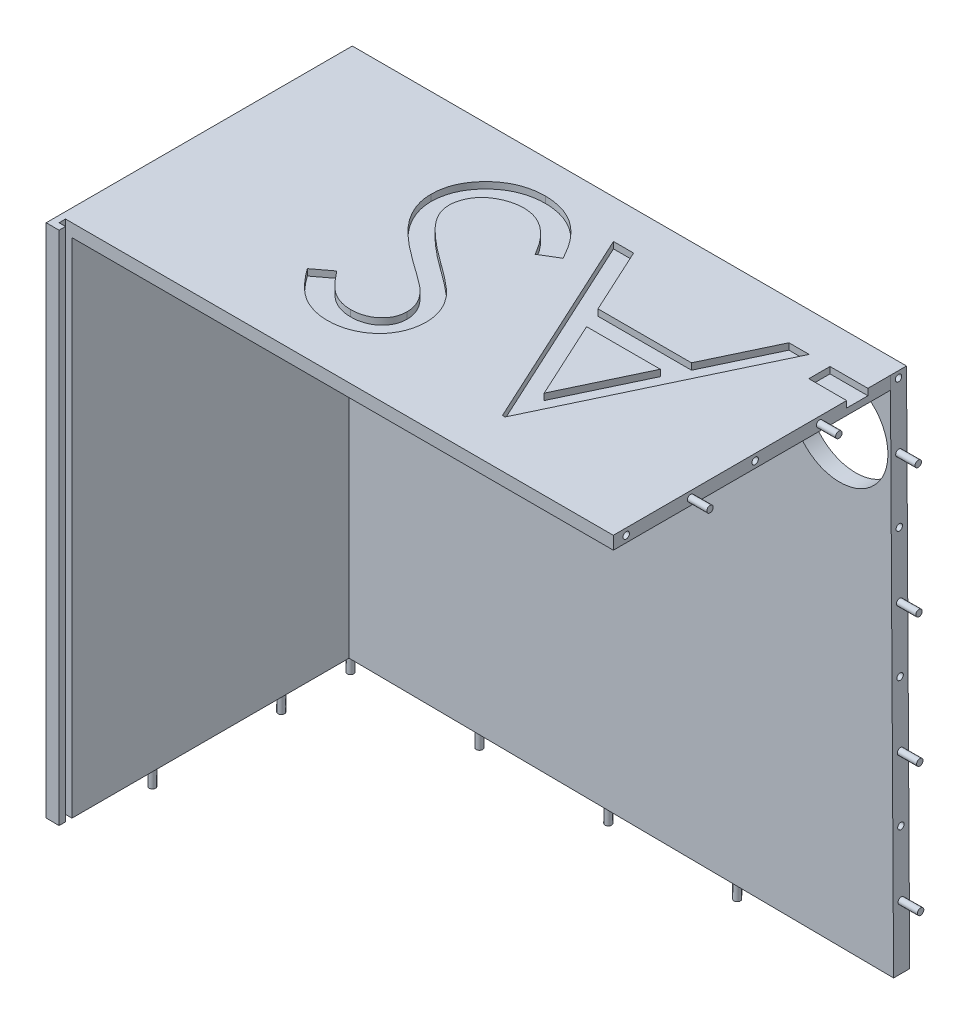
from build123d import *

# Parameters (mm, degrees)
SALIENTE_EXTRUIR1_DEPTH = 2.5
SALIENTE_EXTRUIR2_DEPTH = 45
CROQUIS17_R             = 7.5
CROQUIS17_R_2           = 2
CROQUIS17_R_3           = 1.5
CORTAR_EXTRUIR2_DEPTH   = 45
CORTAR_EXTRUIR3_DEPTH   = 105
CORTAR_EXTRUIR6_DEPTH   = 45
CORTAR_EXTRUIR8_DEPTH   = 1
CORTAR_EXTRUIR9_DEPTH   = 1
CROQUIS22_R             = 0.5
CORTAR_EXTRUIR10_DEPTH  = 4
CROQUIS24_R             = 0.5
SALIENTE_EXTRUIR3_DEPTH = 3
CROQUIS25_R             = 0.5
CORTAR_EXTRUIR11_DEPTH  = 4
CROQUIS27_R             = 0.5
SALIENTE_EXTRUIR4_DEPTH = 3
CROQUIS28_R             = 0.5
SALIENTE_EXTRUIR5_DEPTH = 3
CROQUIS29_R             = 0.5
CORTAR_EXTRUIR12_DEPTH  = 4
CROQUIS30_R             = 0.5
SALIENTE_EXTRUIR6_DEPTH = 3
CROQUIS31_R             = 0.5
CORTAR_EXTRUIR13_DEPTH  = 4


with BuildPart() as part:
    # Croquis15 → Saliente-Extruir1 (new body)
    with BuildSketch(Plane.XY):
        Polygon((0, 80), (-86, 80), (-86, 0), (0.493585448, -0.747010607), align=None)
    extrude(amount=SALIENTE_EXTRUIR1_DEPTH)

    # Croquis16 → Saliente-Extruir2 (add)
    with BuildSketch(Plane.XY.offset(2.5)):
        Polygon((-86, 0), (-84, -0.017027708), (-84, 78), (0.01204005, 78), (0, 80), (-86, 80), align=None)
    extrude(amount=SALIENTE_EXTRUIR2_DEPTH)

    # Croquis17 → Cortar-Extruir2 (cut)
    with BuildSketch(Plane.XY.offset(2.5)):
        with Locations((-7.879599497, 69.200049458)):
            Circle(CROQUIS17_R)
        with Locations((-80, 74)):
            Circle(CROQUIS17_R_2)
        with Locations((-49, 45)):
            Circle(CROQUIS17_R_3)
    extrude(amount=-CORTAR_EXTRUIR2_DEPTH, mode=Mode.SUBTRACT)

    # Croquis18 → Cortar-Extruir3 (cut)
    with BuildSketch(Plane(origin=(0, 80, 0), x_dir=(1, 0, 0), z_dir=(0, 1, 0))):
        Polygon((0, -46.5), (-85, -46.5), (-85, -45.5), (0, -45.5), (0.836064451, -45.5), (0.836064451, -46.5), align=None)
    extrude(amount=-CORTAR_EXTRUIR3_DEPTH, mode=Mode.SUBTRACT)

    # Croquis19 → Cortar-Extruir6 (cut)
    with BuildSketch(Plane(origin=(0, 80, 0), x_dir=(1, 0, 0), z_dir=(0, 1, 0))):
        Polygon((0, -47.5), (-84, -47.5), (-84, -46.5), (0, -46.5), (1.11353995, -46.5), (1.11353995, -47.5), align=None)
    extrude(amount=-CORTAR_EXTRUIR6_DEPTH, mode=Mode.SUBTRACT)

    # Croquis20 → Cortar-Extruir8 (cut)
    with BuildSketch(Plane.ZY.offset(86)):
        with BuildLine():
            Line((42.8897921, 39.727977752), (39.414990694, 47.892710802))
            Line((39.414990694, 47.892710802), (39.175320374, 47.811910054))
            Line((39.175320374, 47.811910054), (36.084007053, 55.49332965))
            ThreePointArc((36.084007053, 55.49332965), (34.421934883, 58.963358815), (32.02982381, 61.976893438))
            ThreePointArc((32.02982381, 61.976893438), (23.84274989, 67.044580137), (14.259741606, 66.108855781))
            Line((14.259741606, 66.108855781), (17.533100352, 66.108855781))
            Line((17.533100352, 66.108855781), (17.793929067, 66.369684496))
            ThreePointArc((17.793929067, 66.369684496), (28.36338955, 63.257555009), (34.992482388, 54.456761125))
            Line((34.992482388, 54.456761125), (37.846876491, 47.364047925))
            Line((37.846876491, 47.364047925), (37.634571287, 47.292472857))
            Line((37.634571287, 47.292472857), (40.778374259, 39.577754196))
            Line((40.778374259, 39.577754196), (37.634571287, 31.930129052))
            Line((37.634571287, 31.930129052), (37.846876491, 31.860535129))
            Line((37.846876491, 31.860535129), (34.51899092, 23.472535747))
            ThreePointArc((34.51899092, 23.472535747), (27.809502812, 15.712037776), (17.947872224, 12.885237188))
            Line((17.947872224, 12.885237188), (17.727881267, 13.105228146))
            Line((17.727881267, 13.105228146), (14.423853052, 13.105228146))
            ThreePointArc((14.423853052, 13.105228146), (22.17340631, 11.809910211), (29.393055563, 14.90992455))
            ThreePointArc((29.393055563, 14.90992455), (33.211326955, 18.443558236), (35.752716257, 22.983063042))
            Line((35.752716257, 22.983063042), (39.272948575, 31.393066837))
            Line((39.272948575, 31.393066837), (39.53262788, 31.307943622))
            Line((39.53262788, 31.307943622), (42.8897921, 39.727977752))
        make_face()
        with BuildLine():
            Line((36.378905898, 46.851834675), (36.084007053, 46.752414574))
            Line((36.084007053, 46.752414574), (32.640801094, 55.132550687))
            ThreePointArc((32.640801094, 55.132550687), (27.524167793, 61.619465369), (19.754472007, 64.428704734))
            Line((19.754472007, 64.428704734), (16.511391589, 64.428704734))
            Line((16.511391589, 64.428704734), (16.708822752, 64.778805627))
            Line((16.708822752, 64.778805627), (11.827523811, 64.778805627))
            ThreePointArc((11.827523811, 64.778805627), (10.608915982, 63.831457631), (9.536616451, 62.72121127))
            Line((9.536616451, 62.72121127), (15.359832149, 62.72121127))
            Line((15.359832149, 62.72121127), (15.511736691, 62.990580681))
            Line((15.511736691, 62.990580681), (19.660348072, 62.990580681))
            ThreePointArc((19.660348072, 62.990580681), (26.8054156, 60.278147026), (31.47565436, 54.228506026))
            Line((31.47565436, 54.228506026), (34.785611277, 46.31468265))
            Line((34.785611277, 46.31468265), (34.433889886, 46.1961058))
            Line((34.433889886, 46.1961058), (37.110752235, 39.627233609))
            Line((37.110752235, 39.627233609), (34.433889886, 32.980380104))
            Line((34.433889886, 32.980380104), (34.728886655, 32.879428436))
            Line((34.728886655, 32.879428436), (31.316821564, 24.514916669))
            ThreePointArc((31.316821564, 24.514916669), (26.041252488, 18.464113022), (18.336433636, 16.210311718))
            Line((18.336433636, 16.210311718), (15.679957488, 16.210311718))
            Line((15.679957488, 16.210311718), (15.452163697, 16.54253363))
            Line((15.452163697, 16.54253363), (9.759164883, 16.54253363))
            ThreePointArc((9.759164883, 16.54253363), (10.728989856, 15.358692755), (11.954185083, 14.441666938))
            Line((11.954185083, 14.441666938), (16.850619146, 14.502980491))
            Line((16.850619146, 14.502980491), (16.667447006, 14.770124728))
            Line((16.667447006, 14.770124728), (19.512924134, 14.770124728))
            ThreePointArc((19.512924134, 14.770124728), (27.395346959, 17.492041697), (32.640801094, 23.97483681))
            Line((32.640801094, 23.97483681), (36.084007053, 32.415688904))
            Line((36.084007053, 32.415688904), (36.414908323, 32.302450257))
            Line((36.414908323, 32.302450257), (39.292664306, 39.577754196))
            Line((39.292664306, 39.577754196), (36.378905898, 46.851834675))
        make_face()
        with BuildLine():
            Line((35.706804957, 39.627233609), (33.162337341, 45.796005131))
            Line((33.162337341, 45.796005131), (32.922678734, 45.715548031))
            Line((32.922678734, 45.715548031), (29.062452452, 54.949970455))
            ThreePointArc((29.062452452, 54.949970455), (24.967702651, 59.263861985), (19.323687612, 61.140489358))
            Line((19.323687612, 61.140489358), (14.259741606, 61.140489358))
            Line((14.259741606, 61.140489358), (14.385275351, 61.445187248))
            Line((14.385275351, 61.445187248), (8.456515485, 61.445187248))
            ThreePointArc((8.456515485, 61.445187248), (7.755035998, 60.452090199), (7.158136913, 59.39283258))
            Line((7.158136913, 59.39283258), (13.154860793, 59.39283258))
            Line((13.154860793, 59.39283258), (13.363644099, 59.717274132))
            Line((13.363644099, 59.717274132), (18.567607292, 59.717274132))
            ThreePointArc((18.567607292, 59.717274132), (24.452832298, 57.927933166), (28.346074774, 53.165551671))
            Line((28.346074774, 53.165551671), (31.593369932, 45.269278514))
            Line((31.593369932, 45.269278514), (31.316821564, 45.176436951))
            Line((31.316821564, 45.176436951), (33.577860357, 39.577754196))
            Line((33.577860357, 39.577754196), (31.316821564, 34.018627994))
            Line((31.316821564, 34.018627994), (31.602317749, 33.922066161))
            Line((31.602317749, 33.922066161), (28.042275456, 25.309983169))
            ThreePointArc((28.042275456, 25.309983169), (24.379497281, 21.196888717), (19.151906793, 19.463167972))
            Line((19.151906793, 19.463167972), (13.514746805, 19.463167972))
            Line((13.514746805, 19.463167972), (13.284980904, 19.847972334))
            Line((13.284980904, 19.847972334), (7.401798859, 19.847972334))
            ThreePointArc((7.401798859, 19.847972334), (7.922755232, 18.773921668), (8.621160615, 17.805825445))
            Line((8.621160615, 17.805825445), (14.603954756, 17.805825445))
            Line((14.603954756, 17.805825445), (14.423853052, 18.107453844))
            Line((14.423853052, 18.107453844), (19.151906793, 18.107453844))
            ThreePointArc((19.151906793, 18.107453844), (25.17240984, 20.020462092), (29.32760377, 24.778657222))
            Line((29.32760377, 24.778657222), (32.922678734, 33.475487595))
            Line((32.922678734, 33.475487595), (33.162337341, 33.394429159))
            Line((33.162337341, 33.394429159), (35.706804957, 39.627233609))
        make_face()
        with BuildLine():
            Line((32.0938438, 39.573448775), (30.001592281, 44.754188061))
            Line((30.001592281, 44.754188061), (29.751017182, 44.66458782))
            Line((29.751017182, 44.66458782), (26.244414428, 53.133099997))
            ThreePointArc((26.244414428, 53.133099997), (23.275186955, 56.429114318), (19.046156691, 57.769011781))
            Line((19.046156691, 57.769011781), (12.100590668, 57.769011781))
            Line((12.100590668, 57.769011781), (12.250050494, 58.04536961))
            Line((12.250050494, 58.04536961), (6.624024953, 58.04536961))
            ThreePointArc((6.624024953, 58.04536961), (6.237685393, 57.055466805), (5.943728696, 56.03431291))
            Line((5.943728696, 56.03431291), (10.926169077, 56.03431291))
            Line((10.926169077, 56.03431291), (11.097634026, 56.351359185))
            Line((11.097634026, 56.351359185), (19.046156691, 56.351359185))
            ThreePointArc((19.046156691, 56.351359185), (22.458473426, 55.196829291), (24.953748351, 52.598666896))
            Line((24.953748351, 52.598666896), (28.360684999, 44.167435075))
            Line((28.360684999, 44.167435075), (28.110544995, 44.077990415))
            Line((28.110544995, 44.077990415), (29.929712795, 39.573448775))
            Line((29.929712795, 39.573448775), (28.163024397, 35.085319779))
            Line((28.163024397, 35.085319779), (28.397224015, 34.976504969))
            Line((28.397224015, 34.976504969), (24.830604314, 26.378839739))
            ThreePointArc((24.830604314, 26.378839739), (22.312085893, 23.862796419), (18.906393231, 22.82613518))
            Line((18.906393231, 22.82613518), (11.349527265, 22.82613518))
            Line((11.349527265, 22.82613518), (11.056235325, 23.177885435))
            Line((11.056235325, 23.177885435), (6.039306832, 23.177885435))
            ThreePointArc((6.039306832, 23.177885435), (6.321052836, 22.154061435), (6.69508021, 21.160230505))
            Line((6.69508021, 21.160230505), (12.395447121, 21.160230505))
            Line((12.395447121, 21.160230505), (12.306728353, 21.434012585))
            Line((12.306728353, 21.434012585), (19.151906793, 21.434012585))
            ThreePointArc((19.151906793, 21.434012585), (23.2575089, 22.718064865), (26.244414428, 25.813731881))
            Line((26.244414428, 25.813731881), (29.73747048, 34.552803382))
            Line((29.73747048, 34.552803382), (30.001592281, 34.463470892))
            Line((30.001592281, 34.463470892), (32.0938438, 39.573448775))
        make_face()
        with BuildLine():
            Line((26.549147801, 35.58790565), (26.85057428, 35.485955799))
            Line((26.85057428, 35.485955799), (28.445515306, 39.573448775))
            Line((28.445515306, 39.573448775), (26.790267285, 43.672099616))
            Line((26.790267285, 43.672099616), (26.549147801, 43.591152077))
            Line((26.549147801, 43.591152077), (23.317591904, 51.41873789))
            ThreePointArc((23.317591904, 51.41873789), (21.513307882, 53.62120693), (18.788989341, 54.448491159))
            Line((18.788989341, 54.448491159), (9.874134615, 54.448491159))
            Line((9.874134615, 54.448491159), (9.974396179, 54.647804874))
            Line((9.974396179, 54.647804874), (5.684786898, 54.647804874))
            Line((5.684786898, 54.647804874), (5.466800204, 52.62607257))
            Line((5.466800204, 52.62607257), (8.708953764, 52.62607257))
            Line((8.708953764, 52.62607257), (8.948743884, 52.971119817))
            Line((8.948743884, 52.971119817), (19.323687612, 53.025155561))
            ThreePointArc((19.323687612, 53.025155561), (20.742059289, 52.420442498), (21.848581651, 51.346634152))
            Line((21.848581651, 51.346634152), (25.232810997, 43.14923746))
            Line((25.232810997, 43.14923746), (24.953748351, 43.055551815))
            Line((24.953748351, 43.055551815), (26.360002357, 39.573448775))
            Line((26.360002357, 39.573448775), (24.997704742, 36.112641857))
            Line((24.997704742, 36.112641857), (25.232810997, 36.033123138))
            Line((25.232810997, 36.033123138), (22.072440339, 28.235984023))
            ThreePointArc((22.072440339, 28.235984023), (20.891743947, 26.805815926), (19.151906793, 26.16363882))
            Line((19.151906793, 26.16363882), (9.088365094, 26.16363882))
            Line((9.088365094, 26.16363882), (8.894687749, 26.495883132))
            Line((8.894687749, 26.495883132), (5.627893891, 26.495883132))
            Line((5.627893891, 26.495883132), (5.777935509, 24.523541078))
            Line((5.777935509, 24.523541078), (10.139925442, 24.523541078))
            Line((10.139925442, 24.523541078), (9.974396179, 24.778657222))
            Line((9.974396179, 24.778657222), (19.151906793, 24.778657222))
            ThreePointArc((19.151906793, 24.778657222), (21.70744673, 25.608994997), (23.383589887, 27.709182919))
            Line((23.383589887, 27.709182919), (26.549147801, 35.58790565))
        make_face()
        with BuildLine():
            Line((21.848581651, 41.991016085), (22.097145968, 42.074462969))
            Line((22.097145968, 42.074462969), (19.061603325, 49.426468222))
            ThreePointArc((19.061603325, 49.426468222), (18.856988582, 49.590244462), (18.597185239, 49.624770866))
            Line((18.597185239, 49.624770866), (7.158136913, 49.624770866))
            Line((7.158136913, 49.624770866), (6.963054512, 49.306532604))
            Line((6.963054512, 49.306532604), (5.471803875, 49.306532604))
            Line((5.471803875, 49.306532604), (5.471803875, 51.264658732))
            Line((5.471803875, 51.264658732), (7.897895425, 51.264658732))
            Line((7.897895425, 51.264658732), (7.770410035, 51.022500789))
            Line((7.770410035, 51.022500789), (18.597185239, 51.022500789))
            ThreePointArc((18.597185239, 51.022500789), (19.792880718, 50.673412458), (20.465116651, 49.624770866))
            Line((20.465116651, 49.624770866), (23.383589887, 42.506342083))
            Line((23.383589887, 42.506342083), (23.691252956, 42.609629332))
            Line((23.691252956, 42.609629332), (24.917420311, 39.573448775))
            Line((24.917420311, 39.573448775), (23.663448956, 36.510831384))
            Line((23.663448956, 36.510831384), (23.383589887, 36.609693561))
            Line((23.383589887, 36.609693561), (20.465116651, 29.323021728))
            ThreePointArc((20.465116651, 29.323021728), (19.798347803, 28.437651312), (18.749435069, 28.079540231))
            Line((18.749435069, 28.079540231), (7.948256078, 28.079540231))
            Line((7.948256078, 28.079540231), (8.019239527, 27.869676635))
            Line((8.019239527, 27.869676635), (5.555168099, 27.869676635))
            Line((5.555168099, 27.869676635), (5.555168099, 29.800069191))
            Line((5.555168099, 29.800069191), (7.089728084, 29.800069191))
            Line((7.089728084, 29.800069191), (7.236688932, 29.52811064))
            Line((7.236688932, 29.52811064), (18.749435069, 29.52811064))
            ThreePointArc((18.749435069, 29.52811064), (18.993561078, 29.600616745), (19.151906793, 29.800069191))
            Line((19.151906793, 29.800069191), (19.328691283, 30.240303042))
            Line((19.328691283, 30.240303042), (22.072440339, 37.072866328))
            Line((22.072440339, 37.072866328), (21.811360071, 37.165094763))
            Line((21.811360071, 37.165094763), (22.797446989, 39.573448775))
            Line((22.797446989, 39.573448775), (21.848581651, 41.991016085))
        make_face()
        Polygon((21.282903507, 39.573448775), (20.465116651, 41.556079733), (20.219012446, 41.473458746), (17.658530134, 47.679543541), (6.487217062, 47.679543541), (6.415653517, 47.892710802), (5.471803875, 47.892710802), (5.471803875, 45.922754828), (5.943728696, 45.922754828), (6.084210416, 46.255690859), (16.708822752, 46.255690859), (18.86886406, 41.020193058), (18.597185239, 40.928986277), (19.129216982, 39.573448775), (18.570319449, 38.208434096), (18.86886406, 38.11743939), (16.758083608, 32.861112837), (6.145199261, 32.861112837), (5.999887867, 33.133770419), (5.555168099, 33.133770419), (5.555168099, 31.222014808), (6.554523547, 31.222014808), (6.554523547, 31.435091919), (17.727881267, 31.435091919), (20.243106325, 37.698578135), (20.465116651, 37.630910645), align=None)
        Polygon((17.622177995, 39.573448775), (17.291311599, 40.416446987), (16.97849747, 40.416446987), (15.401311112, 44.239223747), (5.471803875, 44.239223747), (5.471803875, 42.868185711), (14.482395706, 42.868185711), (15.882323221, 39.573448775), (14.518563776, 36.194537462), (5.471803875, 36.194537462), (5.471803875, 34.882450429), (15.401311112, 34.882450429), (16.97849747, 38.695032164), (17.291311599, 38.695032164), align=None)
        Polygon((13.730826124, 39.573448775), (13.154860793, 40.928986277), (5.471803875, 40.928986277), (5.471803875, 38.208434096), (13.154860793, 38.208434096), align=None)
    extrude(amount=-CORTAR_EXTRUIR8_DEPTH, mode=Mode.SUBTRACT)

    # Croquis21 → Cortar-Extruir9 (cut)
    # profile 1 of 3: a face of its own
    with BuildSketch(Plane(origin=(0, 80, 0), x_dir=(1, 0, 0), z_dir=(0, 1, 0))):
        Polygon((0, -9.29), (-5.872544801, -9.29), (-5.872544801, -6), (0, -6), (0.328032971, -6), (0.328032971, -9.29), align=None)
    # profile 2 of 3: a face of its own
    with BuildSketch(Plane(origin=(0, 80, 0), x_dir=(1, 0, 0), z_dir=(0, 1, 0))):
        Polygon((-24.702370005, -38), (-39.471600774, -6), (-36.349805902, -6), (-31.619036672, -16.256410256), (-17.112626415, -16.256410256), (-12.2472418, -6), (-9.112626415, -6), (-24.292113595, -38), align=None)
        Polygon((-24.465190518, -31.762820513), (-18.670318723, -19.538461538), (-30.106216159, -19.538461538), align=None, mode=Mode.SUBTRACT)
    # profile 3 of 3: a face of its own
    with BuildSketch(Plane(origin=(0, 80, 0), x_dir=(1, 0, 0), z_dir=(0, 1, 0))):
        with BuildLine():
            Line((-41.112626415, -12.173076923), (-43.81775462, -13.794871795))
            add(Edge.make_bspline(
                [(-43.81775462, -13.794871795), (-44.069349932, -13.373711704), (-44.551396841, -12.566785222), (-45.355523553, -11.476425996), (-46.188738741, -10.549686277), (-47.057212648, -9.791957294), (-47.955644173, -9.195396043), (-48.889898379, -8.772975639), (-49.856826934, -8.509515293), (-50.514873302, -8.477514501), (-50.843395646, -8.461538462)],
                knots=[0, 0, 0, 0, 1.272034388, 2.437168799, 3.508375237, 4.49857839, 5.41946034, 6.295179144, 7.148887113, 8, 8, 8, 8], degree=3))
            add(Edge.make_bspline(
                [(-50.843395646, -8.461538462), (-51.123904457, -8.469538503), (-51.680013833, -8.485398603), (-52.500300487, -8.631636929), (-53.292978758, -8.870881752), (-54.05015931, -9.195206772), (-54.751816877, -9.593862935), (-55.376873827, -10.063987637), (-55.905003569, -10.607078531), (-56.341623623, -11.203554004), (-56.683417027, -11.84096317), (-56.926611177, -12.503608358), (-57.082833828, -13.187267012), (-57.102640621, -13.650880161), (-57.112626415, -13.884615385)],
                knots=[0, 0, 0, 0, 1.095645842, 2.172120455, 3.244862764, 4.326153987, 5.384857088, 6.392105572, 7.372507978, 8.334705661, 9.272564127, 10.189475455, 11.087205874, 12, 12, 12, 12], degree=3))
            add(Edge.make_bspline(
                [(-57.112626415, -13.884615385), (-57.099436512, -14.151134937), (-57.072725519, -14.690866093), (-56.837319767, -15.488538477), (-56.477865034, -16.2813363), (-56.140017983, -16.771825194), (-55.965190518, -17.025641026)],
                knots=[0, 0, 0, 0, 0.938992559, 1.901562324, 2.914110574, 4, 4, 4, 4], degree=3))
            add(Edge.make_bspline(
                [(-55.965190518, -17.025641026), (-55.822342995, -17.209324177), (-55.521572201, -17.596075913), (-54.996888608, -18.161659562), (-54.400290306, -18.760508265), (-53.716331146, -19.380669099), (-52.95498472, -20.03482794), (-52.107619506, -20.710852626), (-51.184129811, -21.418825793), (-50.532765632, -21.886421712), (-50.195959748, -22.128205128)],
                knots=[0, 0, 0, 0, 0.722283655, 1.520795216, 2.39349503, 3.346893347, 4.386874146, 5.510198126, 6.712579003, 8, 8, 8, 8], degree=3))
            add(Edge.make_bspline(
                [(-50.195959748, -22.128205128), (-49.859328121, -22.368064246), (-49.215714084, -22.826656614), (-48.314940744, -23.506397616), (-47.510531053, -24.131834442), (-46.798386144, -24.694254987), (-46.196930107, -25.218189187), (-45.684175391, -25.675557096), (-45.279039456, -26.090781639), (-45.053590865, -26.359928793), (-44.952370005, -26.480769231)],
                knots=[0, 0, 0, 0, 1.452255772, 2.776602448, 3.96446981, 5.032613149, 5.964194703, 6.766668629, 7.446264616, 8, 8, 8, 8], degree=3))
            add(Edge.make_bspline(
                [(-44.952370005, -26.480769231), (-44.810930445, -26.669130918), (-44.532770568, -27.039569455), (-44.165200642, -27.618406346), (-43.855227923, -28.209812845), (-43.605757837, -28.815932341), (-43.404020831, -29.432209485), (-43.263761858, -30.063271043), (-43.177309193, -30.704832993), (-43.16837888, -31.136484341), (-43.163908466, -31.352564103)],
                knots=[0, 0, 0, 0, 1.068019517, 2.100403715, 3.106014851, 4.09224787, 5.069873182, 6.043214339, 7.020455327, 8, 8, 8, 8], degree=3))
            add(Edge.make_bspline(
                [(-43.163908466, -31.352564103), (-43.175789221, -31.69115105), (-43.199296787, -32.361087886), (-43.39974445, -33.339234609), (-43.71238884, -34.275998423), (-44.164713605, -35.150530353), (-44.723419315, -35.961590683), (-45.386604056, -36.694791903), (-46.166687401, -37.324896325), (-47.035119381, -37.860535452), (-47.974583795, -38.287856007), (-48.961905795, -38.599228535), (-49.992648887, -38.781711844), (-50.693107311, -38.80745208), (-51.048523851, -38.820512821)],
                knots=[0, 0, 0, 0, 1.005367131, 1.989245246, 2.955191616, 3.932180104, 4.904534562, 5.875498653, 6.859376768, 7.874484044, 8.900379497, 9.918679785, 10.943926428, 12, 12, 12, 12], degree=3))
            add(Edge.make_bspline(
                [(-51.048523851, -38.820512821), (-51.425729305, -38.807925845), (-52.173772824, -38.782964369), (-53.274431324, -38.552582615), (-54.340468726, -38.194629515), (-55.194814041, -37.768314274), (-55.863711082, -37.347115494), (-56.373280577, -36.962497818), (-56.892471088, -36.520665467), (-57.41568854, -36.01225838), (-57.948102447, -35.447458642), (-58.487259126, -34.821481191), (-59.038204531, -34.139968271), (-59.392523906, -33.653323446), (-59.574164877, -33.403846154)],
                knots=[0, 0, 0, 0, 1.286534051, 2.551350862, 3.822568981, 5.117864672, 5.799956111, 6.519305446, 7.295594771, 8.126302591, 9.008831062, 9.944975596, 10.946496709, 12, 12, 12, 12], degree=3))
            Line((-59.574164877, -33.403846154), (-56.97801103, -31.435897436))
            add(Edge.make_bspline(
                [(-56.97801103, -31.435897436), (-56.82125965, -31.63786287), (-56.519393141, -32.026801075), (-56.06091435, -32.571297557), (-55.62944197, -33.069346749), (-55.201083907, -33.500802452), (-54.808859385, -33.897978554), (-54.421417155, -34.231979372), (-54.053724677, -34.513408403), (-53.591310449, -34.81413939), (-53.004043072, -35.105098841), (-52.273720663, -35.355254615), (-51.510009295, -35.508990176), (-50.99154251, -35.528529762), (-50.72801103, -35.538461538)],
                knots=[0, 0, 0, 0, 1.181426797, 2.275151783, 3.28963443, 4.225459815, 5.084396437, 5.868484344, 6.587427557, 7.222918358, 8.415355282, 9.605213164, 10.782753814, 12, 12, 12, 12], degree=3))
            add(Edge.make_bspline(
                [(-50.72801103, -35.538461538), (-50.3973591, -35.527564542), (-49.759728001, -35.50655071), (-48.856587512, -35.271009007), (-48.039019993, -34.912883718), (-47.338235945, -34.396470786), (-46.759609424, -33.780807103), (-46.335859058, -33.078686031), (-46.082506162, -32.303220628), (-46.051496209, -31.762539628), (-46.035703338, -31.487179487)],
                knots=[0, 0, 0, 0, 1.144248881, 2.206576175, 3.214949548, 4.222996039, 5.203671638, 6.127710127, 7.046472867, 8, 8, 8, 8], degree=3))
            add(Edge.make_bspline(
                [(-46.035703338, -31.487179487), (-46.03967282, -31.315821764), (-46.04766708, -30.970719235), (-46.142978077, -30.461901896), (-46.285209758, -29.959074513), (-46.486819234, -29.459340064), (-46.760808899, -28.948461551), (-47.132934965, -28.429350882), (-47.598601464, -27.889016072), (-47.955988243, -27.537928019), (-48.144677697, -27.352564103)],
                knots=[0, 0, 0, 0, 0.858500039, 1.728959331, 2.587258638, 3.476905708, 4.426389682, 5.487945037, 6.673710648, 8, 8, 8, 8], degree=3))
            add(Edge.make_bspline(
                [(-48.144677697, -27.352564103), (-48.214724531, -27.290054152), (-48.381139773, -27.141544819), (-48.685376808, -26.898415396), (-49.087139535, -26.598504335), (-49.575936803, -26.227420299), (-50.160781253, -25.796961216), (-50.841737195, -25.312631048), (-51.611214067, -24.758706851), (-52.157243012, -24.371437909), (-52.445959748, -24.166666667)],
                knots=[0, 0, 0, 0, 0.420754252, 0.999615792, 1.744751191, 2.668019286, 3.750313428, 4.999500688, 6.413464383, 8, 8, 8, 8], degree=3))
            add(Edge.make_bspline(
                [(-52.445959748, -24.166666667), (-52.793259282, -23.913945486), (-53.465756694, -23.424585947), (-54.42262931, -22.689359287), (-55.290218492, -21.970285705), (-56.071634475, -21.272003932), (-56.774382104, -20.599654572), (-57.391377273, -19.945669922), (-57.925419439, -19.314338722), (-58.508205743, -18.510436969), (-59.096647152, -17.513971319), (-59.601187295, -16.292562634), (-59.922167096, -15.067648888), (-59.963853517, -14.245423492), (-59.984421287, -13.83974359)],
                knots=[0, 0, 0, 0, 1.163604038, 2.253157948, 3.268574773, 4.215621239, 5.091738613, 5.902582348, 6.650434646, 7.330118262, 8.591011492, 9.77460283, 10.902005569, 12, 12, 12, 12], degree=3))
            add(Edge.make_bspline(
                [(-59.984421287, -13.83974359), (-59.978403703, -13.552860982), (-59.966485392, -12.984666834), (-59.829837513, -12.150257603), (-59.628917333, -11.340204961), (-59.329469972, -10.564589647), (-58.955152078, -9.814767366), (-58.499423031, -9.092052837), (-57.947131319, -8.408321036), (-57.333601486, -7.750293698), (-56.652125074, -7.15517303), (-55.930983887, -6.6251084), (-55.174225525, -6.171255233), (-54.373207945, -5.814698107), (-53.541126087, -5.529482894), (-52.67407409, -5.325048135), (-51.770188836, -5.199150622), (-51.155775548, -5.186114833), (-50.843395646, -5.179487179)],
                knots=[0, 0, 0, 0, 0.98378539, 1.948466333, 2.894822735, 3.844243623, 4.795447569, 5.768042124, 6.770299647, 7.807997672, 8.852593179, 9.870666288, 10.876941106, 11.874841786, 12.874492863, 13.892063892, 14.928283473, 16, 16, 16, 16], degree=3))
            add(Edge.make_bspline(
                [(-50.843395646, -5.179487179), (-50.601711749, -5.184214393), (-50.121387715, -5.193609285), (-49.412837329, -5.274698479), (-48.717298123, -5.393616811), (-48.043503217, -5.574924036), (-47.383063429, -5.800079369), (-46.741862786, -6.075747428), (-46.11835453, -6.403924001), (-45.511768451, -6.785116712), (-44.916552571, -7.224542402), (-44.335109104, -7.73190567), (-43.764527364, -8.304777966), (-43.202437221, -8.94236208), (-42.66207942, -9.655196828), (-42.129865577, -10.431977483), (-41.608566952, -11.275213534), (-41.281027636, -11.868199059), (-41.112626415, -12.173076923)],
                knots=[0, 0, 0, 0, 0.915366252, 1.81920441, 2.69897508, 3.586533125, 4.459536084, 5.340758185, 6.227946952, 7.126403341, 8.052553006, 9.028121456, 10.047063623, 11.114014537, 12.24582441, 13.433687931, 14.680555077, 16, 16, 16, 16], degree=3))
        make_face()
    extrude(amount=-CORTAR_EXTRUIR9_DEPTH, mode=Mode.SUBTRACT)

    # Croquis22 → Cortar-Extruir10 (cut)
    with BuildSketch(Plane(origin=(0.489000895, 0.002989135, 0), x_dir=(0, 0, -1), z_dir=(0.9999813177309185, 0.006112625388174917, 0))):
        with Locations(Location((-1.25, 78.998505418, 0), (0, 0, 90))):
            Circle(CROQUIS22_R)
        with Locations(Location((-1.25, 58.998505418, 0), (0, 0, 90))):
            Circle(CROQUIS22_R)
        with Locations(Location((-1.25, 38.998505418, 0), (0, 0, 90))):
            Circle(CROQUIS22_R)
        with Locations(Location((-1.25, 18.998505418, 0), (0, 0, 90))):
            Circle(CROQUIS22_R)
    extrude(amount=-CORTAR_EXTRUIR10_DEPTH, mode=Mode.SUBTRACT)

    # Croquis24 → Saliente-Extruir3 (add)
    with BuildSketch(Plane(origin=(0.489000895, 0.002989135, 0), x_dir=(0, 0, -1), z_dir=(0.9999813177309185, 0.006112625388174917, 0))):
        with Locations(Location((-1.25, 68.998505418, 0), (0, 0, 270))):
            Circle(CROQUIS24_R)
        with Locations(Location((-1.25, 48.998505418, 0), (0, 0, 270))):
            Circle(CROQUIS24_R)
        with Locations(Location((-1.25, 28.998505418, 0), (0, 0, 270))):
            Circle(CROQUIS24_R)
        with Locations(Location((-1.25, 8.998505418, 0), (0, 0, 270))):
            Circle(CROQUIS24_R)
    extrude(amount=SALIENTE_EXTRUIR3_DEPTH)

    # Croquis25 → Cortar-Extruir11 (cut)
    with BuildSketch(Plane(origin=(0.481584557, 0.002899151, 0), x_dir=(0, 0, -1), z_dir=(0.9999818801412468, 0.006019916044037572, 0))):
        with Locations(Location((-43.5, 78.998532291, 0), (0, 0, 90))):
            Circle(CROQUIS25_R)
        with Locations(Location((-23.5, 78.998532291, 0), (0, 0, 90))):
            Circle(CROQUIS25_R)
    extrude(amount=-CORTAR_EXTRUIR11_DEPTH, mode=Mode.SUBTRACT)

    # Croquis27 → Saliente-Extruir4 (add)
    with BuildSketch(Plane(origin=(0.481584557, 0.002899151, 0), x_dir=(0, 0, -1), z_dir=(0.9999818801412468, 0.006019916044037572, 0))):
        with Locations(Location((-33.5, 78.998532291, 0), (0, 0, 270))):
            Circle(CROQUIS27_R)
        with Locations(Location((-13.5, 78.998532291, 0), (0, 0, 270))):
            Circle(CROQUIS27_R)
    extrude(amount=SALIENTE_EXTRUIR4_DEPTH)

    # Croquis28 → Saliente-Extruir5 (add)
    with BuildSketch(Plane(origin=(-0.006414337, -0.742692308, 0), x_dir=(0.9999627066458414, -0.008636279148040542, 0), z_dir=(-0.008636279148040542, -0.9999627066458414, 0))):
        with Locations(Location((-84.996792772, 1.25, 0), (0, 0, 180))):
            Circle(CROQUIS28_R)
        with Locations(Location((-64.996792772, 1.25, 0), (0, 0, 180))):
            Circle(CROQUIS28_R)
        with Locations(Location((-44.996792772, 1.25, 0), (0, 0, 180))):
            Circle(CROQUIS28_R)
        with Locations(Location((-24.996792772, 1.25, 0), (0, 0, 180))):
            Circle(CROQUIS28_R)
    extrude(amount=SALIENTE_EXTRUIR5_DEPTH)

    # Croquis29 → Cortar-Extruir12 (cut)
    with BuildSketch(Plane(origin=(-0.006414337, -0.742692308, 0), x_dir=(0.9999627066458414, -0.008636279148040542, 0), z_dir=(-0.008636279148040542, -0.9999627066458414, 0))):
        with Locations((-74.996792772, 1.25)):
            Circle(CROQUIS29_R)
        with Locations((-54.996792772, 1.25)):
            Circle(CROQUIS29_R)
        with Locations((-34.996792772, 1.25)):
            Circle(CROQUIS29_R)
        with Locations((-14.996792772, 1.25)):
            Circle(CROQUIS29_R)
    extrude(amount=-CORTAR_EXTRUIR12_DEPTH, mode=Mode.SUBTRACT)

    # Croquis30 → Saliente-Extruir6 (add)
    with BuildSketch(Plane(origin=(-0.006233319, -0.732138357, 0), x_dir=(0.9999637591169493, -0.008513545248592774, 0), z_dir=(-0.008513545248592772, -0.9999637591169492, 0))):
        with Locations(Location((-84.996847042, 12, 0), (0, 0, 180))):
            Circle(CROQUIS30_R)
        with Locations(Location((-84.996847042, 32, 0), (0, 0, 180))):
            Circle(CROQUIS30_R)
    extrude(amount=SALIENTE_EXTRUIR6_DEPTH)

    # Croquis31 → Cortar-Extruir13 (cut)
    with BuildSketch(Plane(origin=(-0.006233319, -0.732138357, 0), x_dir=(0.9999637591169493, -0.008513545248592774, 0), z_dir=(-0.008513545248592772, -0.9999637591169492, 0))):
        with Locations((-84.996847042, 42)):
            Circle(CROQUIS31_R)
        with Locations((-84.996847042, 22)):
            Circle(CROQUIS31_R)
    extrude(amount=-CORTAR_EXTRUIR13_DEPTH, mode=Mode.SUBTRACT)


solid = part.part
